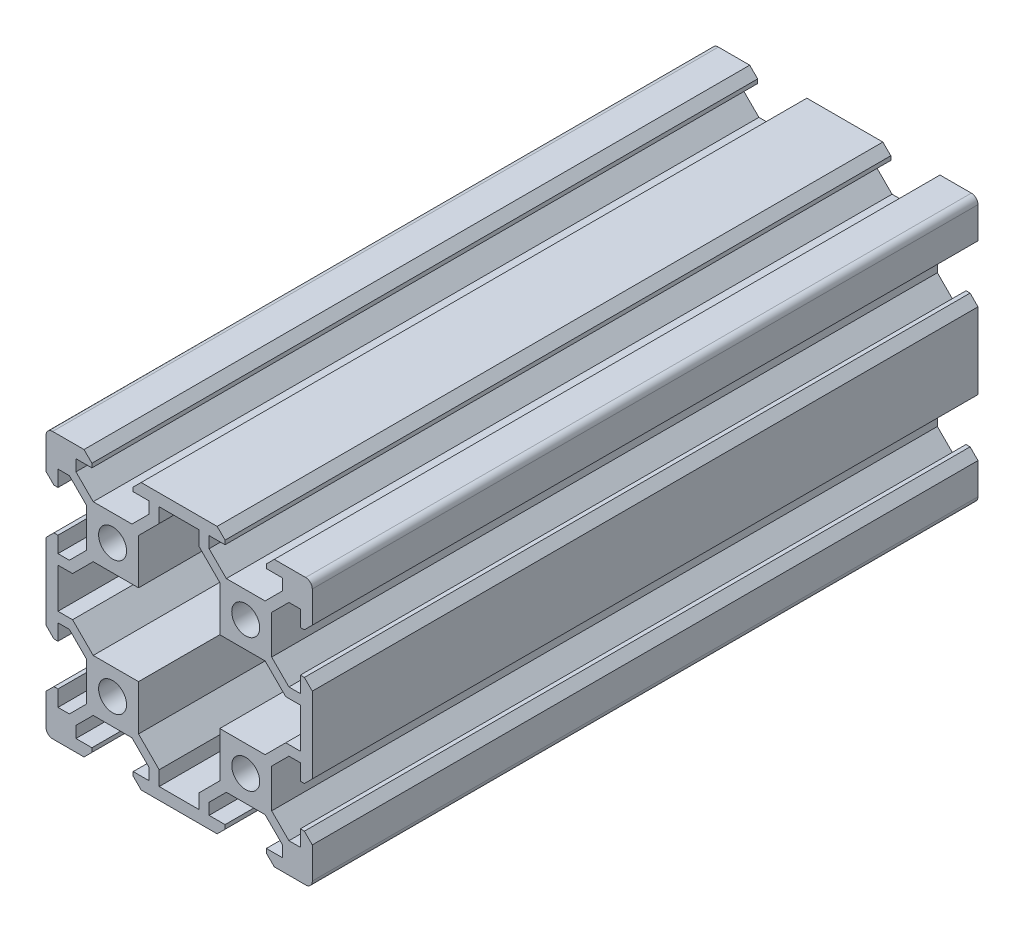
from build123d import *

# Parameters (mm, degrees)
SKETCH_1_R      = 2.1
EXTRUDE_1_DEPTH = 100
VERRUNDUNG1_R   = 1


with BuildPart() as part:
    # 草图1 → 凸台-拉伸1 (new body)
    with BuildSketch(Plane.XY):
        Polygon((5.71, 20), (-5.71, 20), (-6.9, 18.81), (-6.9, 18.2), (-4.5, 18.2), (-4.5, 16.489949494), (-7.089949494, 13.9), (-12.910050506, 13.9), (-15.5, 16.489949494), (-15.5, 18.2), (-13.1, 18.2), (-13.1, 18.81), (-14.29, 20), (-20, 20), (-20, 14.29), (-18.81, 13.1), (-18.2, 13.1), (-18.2, 15.5), (-16.489949494, 15.5), (-13.9, 12.910050506), (-13.9, 7.089949494), (-16.489949494, 4.5), (-18.2, 4.5), (-18.2, 6.9), (-18.81, 6.9), (-20, 5.71), (-20, -5.71), (-18.81, -6.9), (-18.2, -6.9), (-18.2, -4.5), (-16.489949494, -4.5), (-13.9, -7.089949494), (-13.9, -12.910050506), (-16.489949494, -15.5), (-18.2, -15.5), (-18.2, -13.1), (-18.81, -13.1), (-20, -14.29), (-20, -20), (-14.29, -20), (-13.1, -18.81), (-13.1, -18.2), (-15.5, -18.2), (-15.5, -16.489949494), (-12.910050506, -13.9), (-7.089949494, -13.9), (-4.5, -16.489949494), (-4.5, -18.2), (-6.9, -18.2), (-6.9, -18.81), (-5.71, -20), (5.71, -20), (6.9, -18.81), (6.9, -18.2), (4.5, -18.2), (4.5, -16.489949494), (7.089949494, -13.9), (12.910050506, -13.9), (15.5, -16.489949494), (15.5, -18.2), (13.1, -18.2), (13.1, -18.81), (14.29, -20), (20, -20), (20, -14.29), (18.81, -13.1), (18.2, -13.1), (18.2, -15.5), (16.489949494, -15.5), (13.9, -12.910050506), (13.9, -7.089949494), (16.489949494, -4.5), (18.2, -4.5), (18.2, -6.9), (18.81, -6.9), (20, -5.71), (20, 5.71), (18.81, 6.9), (18.2, 6.9), (18.2, 4.5), (16.489949494, 4.5), (13.9, 7.089949494), (13.9, 12.910050506), (16.489949494, 15.5), (18.2, 15.5), (18.2, 13.1), (18.81, 13.1), (20, 14.29), (20, 20), (14.29, 20), (13.1, 18.81), (13.1, 18.2), (15.5, 18.2), (15.5, 16.489949494), (12.910050506, 13.9), (7.089949494, 13.9), (4.5, 16.489949494), (4.5, 18.2), (6.9, 18.2), (6.9, 18.81), align=None)
        with Locations((-10, 10)):
            Circle(SKETCH_1_R, mode=Mode.SUBTRACT)
        with Locations(Location((-10, -10, 0), (0, 0, 180))):
            Circle(SKETCH_1_R, mode=Mode.SUBTRACT)
        with Locations((10, -10)):
            Circle(SKETCH_1_R, mode=Mode.SUBTRACT)
        with Locations(Location((10, 10, 0), (0, 0, 180))):
            Circle(SKETCH_1_R, mode=Mode.SUBTRACT)
        Polygon((-6.1, 6.1), (-6.1, 12.910050506), (-3, 16.010050506), (-3, 18.2), (3, 18.2), (3, 16.010050506), (6.1, 12.910050506), (6.1, 6.1), (12.910050506, 6.1), (16.010050506, 3), (18.2, 3), (18.2, -3), (16.010050506, -3), (12.910050506, -6.1), (6.1, -6.1), (6.1, -12.910050506), (3, -16.010050506), (3, -18.2), (-3, -18.2), (-3, -16.010050506), (-6.1, -12.910050506), (-6.1, -6.1), (-12.910050506, -6.1), (-16.010050506, -3), (-18.2, -3), (-18.2, 3), (-16.010050506, 3), (-12.910050506, 6.1), align=None, mode=Mode.SUBTRACT)
    extrude(amount=EXTRUDE_1_DEPTH)

    # Verrundung1
    verrundung1_edges = [part.edges().sort_by_distance(p)[0] for p in [
        (20, 20, 50),
        (20, -20, 50),
        (-20, -20, 50),
        (-20, 20, 50),
    ]]
    fillet(verrundung1_edges, radius=VERRUNDUNG1_R)


solid = part.part
